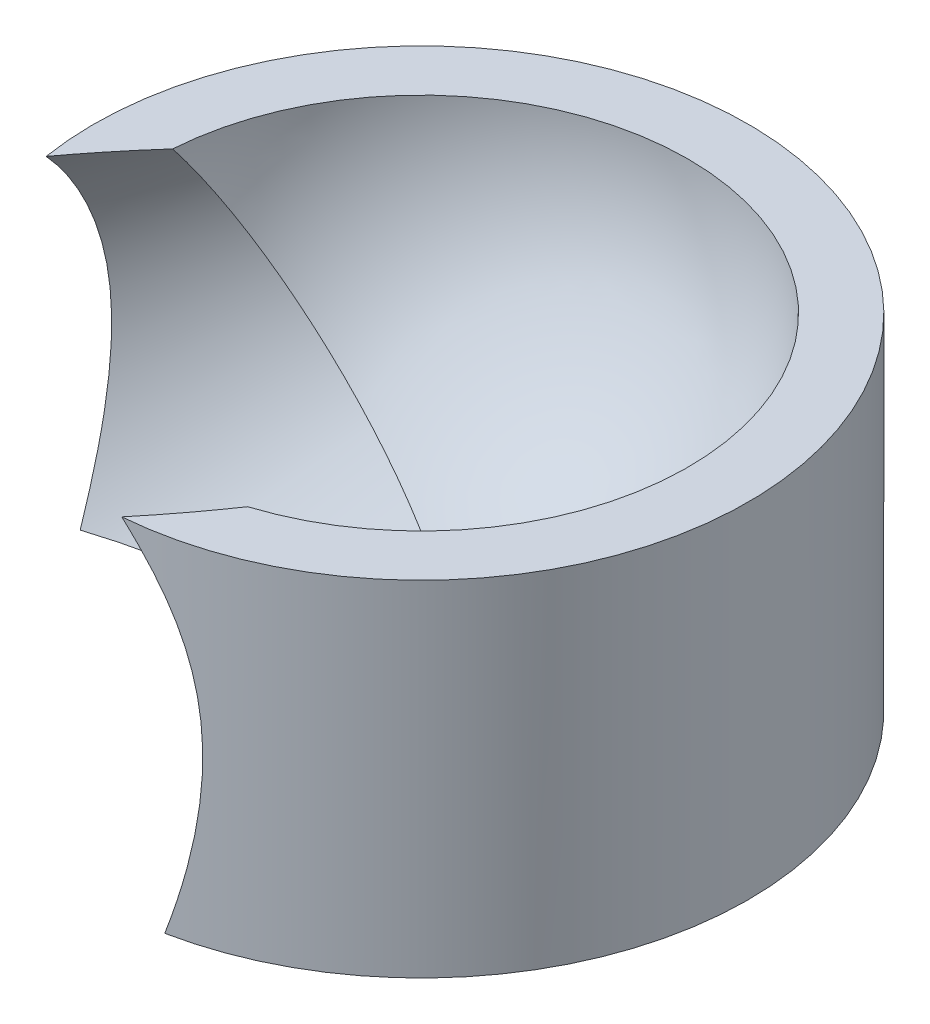
from build123d import *

# Parameters (mm, degrees)
KEYED_BACK_DEPTH   = 0.7
CUP_BLANK_SKETCH_R = 3.8
CUP_BLANK_DEPTH    = 3.3


with BuildPart() as part:
    # Keyed Back Sketch → Keyed Back (new body)
    with BuildSketch(Plane(origin=(0, -97, 0), x_dir=(-1, 0, 0), z_dir=(0, -1, 0))):
        with BuildLine():
            Line((29.790988145, 11.23573341), (33.83079012, 13.568114168))
            ThreePointArc((33.83079012, 13.568114168), (28.410889132, 18.290896534), (29.790988145, 11.23573341))
        make_face()
    extrude(amount=KEYED_BACK_DEPTH)

    # Cup Blank Sketch → Cup Blank (add)
    with BuildSketch(Plane(origin=(0, -97.7, 0), x_dir=(-1, 0, 0), z_dir=(0, -1, 0))):
        with Locations(Location((30.310889132, 15, 0), (0, 0, 262.136353638))):
            Circle(CUP_BLANK_SKETCH_R)
    extrude(amount=CUP_BLANK_DEPTH)

    # Spherical Bearing Seat profile → Spherical Bearing Seat (revolve, cut)
    with BuildSketch(Plane(origin=(0, -101, 0), x_dir=(-1, 0, 0), z_dir=(0, -1, 0))):
        with BuildLine():
            Line((30.310889132, 11.9), (30.310889132, 18.1))
            ThreePointArc((30.310889132, 18.1), (27.210889132, 15), (30.310889132, 11.9))
        make_face()
    revolve(axis=Axis((-30.310889132, -101, -25), (0, 0, 1)), mode=Mode.SUBTRACT)

    # Articulation Throat Sketch → Articulation Throat (revolve, cut)
    with BuildSketch(Plane(origin=(-55.559435073, -21.315405316, -26.260716517), x_dir=(0.37694407644157146, 0.1446147852349051, -0.9148768917876727), z_dir=(0.8541721659092646, 0.32770358269776195, 0.4037329227012915))):
        Polygon((-12.308450042, -83.441173866), (-10.724100051, -81.773890115), (-22.767880189, -61.059022025), (-28.981287547, -67.597673951), align=None)
    revolve(axis=Axis((-25.110986143, -106.383086561, -21.631997284), (-0.5199902989343897, 0.5383086561091633, 0.6631997284167648)), mode=Mode.SUBTRACT)


with BuildPart() as body_2:
    # Mirror1: mirrored copy
    add(part.part.mirror(Plane(origin=(0, 0, 0), x_dir=(0, 0, 1), z_dir=(0, -1, 0))))


solid = body_2.part
